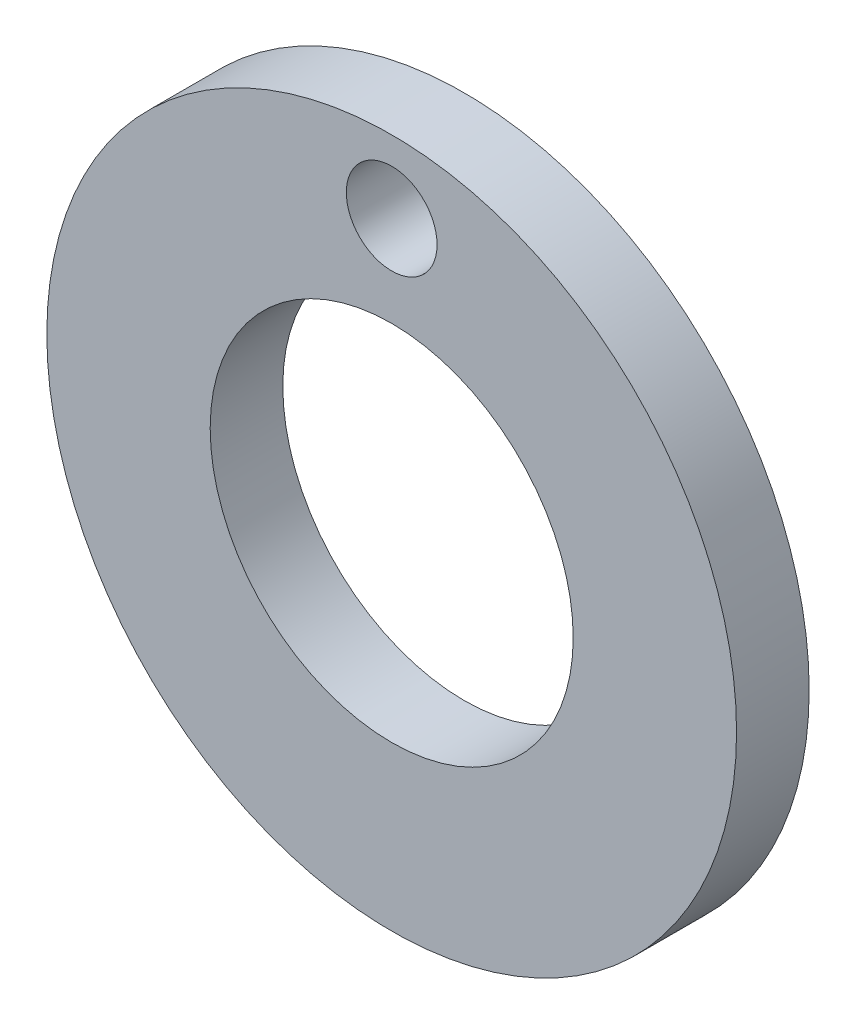
from build123d import *

# Parameters (mm, degrees)
CROQUIS1_R              = 9.5
CROQUIS1_R_2            = 5
CROQUIS1_R_3            = 1.25
SALIENTE_EXTRUIR1_DEPTH = 2


with BuildPart() as part:
    # Croquis1 → Saliente-Extruir1 (new body)
    with BuildSketch(Plane.XY):
        Circle(CROQUIS1_R)
        Circle(CROQUIS1_R_2, mode=Mode.SUBTRACT)
        with Locations((0, 7.5)):
            Circle(CROQUIS1_R_3, mode=Mode.SUBTRACT)
    extrude(amount=SALIENTE_EXTRUIR1_DEPTH)


solid = part.part
